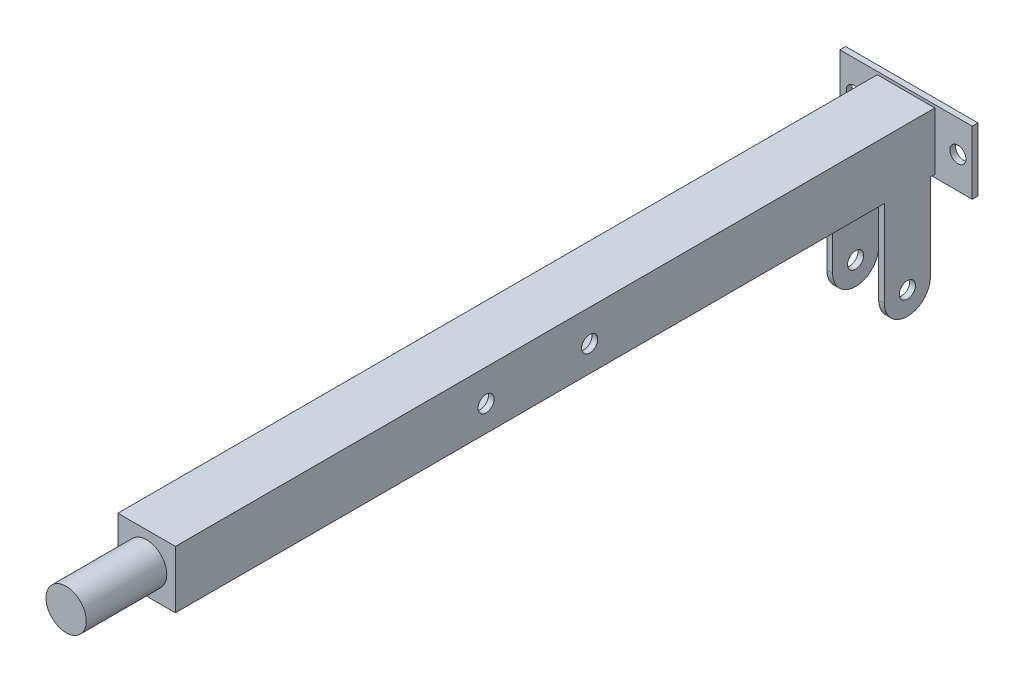
from build123d import *

# Parameters (mm, degrees)
SKETCH1_R               = 17.5
BOSS_EXTRUDE1_DEPTH     = 70
SKETCH4_W               = 50
SKETCH4_H               = 50
CUT_EXTRUDE1_DEPTH      = 731.855662905
CUT_EXTRUDE1_DEPTH_BACK = 650
SKETCH5_W               = 40
SKETCH5_H               = 40
SKETCH6_W               = 115
SKETCH6_H               = 55
SKETCH6_R               = 7
BOSS_EXTRUDE2_DEPTH     = 5
BOSS_EXTRUDE4_DEPTH     = 5
SKETCH13_R              = 7
CUT_EXTRUDE4_DEPTH      = 681.757849753
CUT_EXTRUDE5_DEPTH      = 681.757849753
CUT_EXTRUDE5_DEPTH_BACK = 681.757849753
SKETCH14_R              = 7


with BuildPart() as part:
    # Sketch1 → Boss-Extrude1 (new body)
    with BuildSketch(Plane.XY):
        Circle(SKETCH1_R)
    extrude(amount=BOSS_EXTRUDE1_DEPTH)

    # Sweep1: sweep along a path in Sketch3
    with BuildLine(Plane(origin=(0, 0, 0), x_dir=(1, 0, 0), z_dir=(0, 1, 0))) as sweep1_path:
        Line((0, 0), (0, 660))
    # Sketch4 → Sweep1 (sweep)
    with BuildSketch(Plane(origin=(0, 0, 0), x_dir=(-1, 0, 0), z_dir=(0, 0, -1))):
        Rectangle(SKETCH4_W, SKETCH4_H)
    sweep(path=sweep1_path.line)

    # Sketch5 → Cut-Extrude1 (cut, two sides: drawn at the far end of the back side and taken through both)
    with BuildSketch(Plane(origin=(0, 0, -660), x_dir=(-1, 0, 0), z_dir=(0, 0, -1)).offset(-CUT_EXTRUDE1_DEPTH_BACK)):
        Rectangle(SKETCH5_W, SKETCH5_H)
    extrude(amount=CUT_EXTRUDE1_DEPTH + CUT_EXTRUDE1_DEPTH_BACK, mode=Mode.SUBTRACT)

    # Sketch6 → Boss-Extrude2 (add)
    with BuildSketch(Plane(origin=(0, 0, -660), x_dir=(-1, 0, 0), z_dir=(0, 0, -1))):
        Rectangle(SKETCH6_W, SKETCH6_H)
        with Locations((-45, 0)):
            Circle(SKETCH6_R, mode=Mode.SUBTRACT)
        with Locations((45, 0)):
            Circle(SKETCH6_R, mode=Mode.SUBTRACT)
    extrude(amount=BOSS_EXTRUDE2_DEPTH)

    # Sketch12 → Boss-Extrude4 (add)
    with BuildSketch(Plane.ZY.offset(25)):
        with BuildLine():
            Line((-616.140431975, -25), (-656.140431975, -25))
            Line((-656.140431975, -25), (-656.140431975, -100))
            ThreePointArc((-656.140431975, -100), (-636.140431975, -120), (-616.140431975, -100))
            Line((-616.140431975, -100), (-616.140431975, -25))
        make_face()
    boss_extrude4 = extrude(amount=-BOSS_EXTRUDE4_DEPTH)

    # Sketch13 → Cut-Extrude4 (cut, through all)
    with BuildSketch(Plane.ZY.offset(25)):
        with Locations((-636.140431975, -100)):
            Circle(SKETCH13_R)
    cut_extrude4 = extrude(amount=-CUT_EXTRUDE4_DEPTH, mode=Mode.SUBTRACT)

    # Mirror1: Boss-Extrude4 across plane
    add(boss_extrude4.mirror(Plane(origin=(0, 0, 0), x_dir=(0, 0, 1), z_dir=(1, 0, 0))))

    # Mirror2: Cut-Extrude4 across plane
    add(cut_extrude4.mirror(Plane(origin=(0, 0, 0), x_dir=(0, 0, 1), z_dir=(1, 0, 0))), mode=Mode.SUBTRACT)

    # Sketch14 → Cut-Extrude5 (cut, two sides: drawn at the far end of the back side and taken through both)
    with BuildSketch(Plane(origin=(25, 0, 0), x_dir=(0, 0, -1), z_dir=(1, 0, 0)).offset(-CUT_EXTRUDE5_DEPTH_BACK)):
        with Locations((270, -2.5)):
            Circle(SKETCH14_R)
        with Locations((360, -2.5)):
            Circle(SKETCH14_R)
    extrude(amount=CUT_EXTRUDE5_DEPTH + CUT_EXTRUDE5_DEPTH_BACK, mode=Mode.SUBTRACT)


solid = part.part
